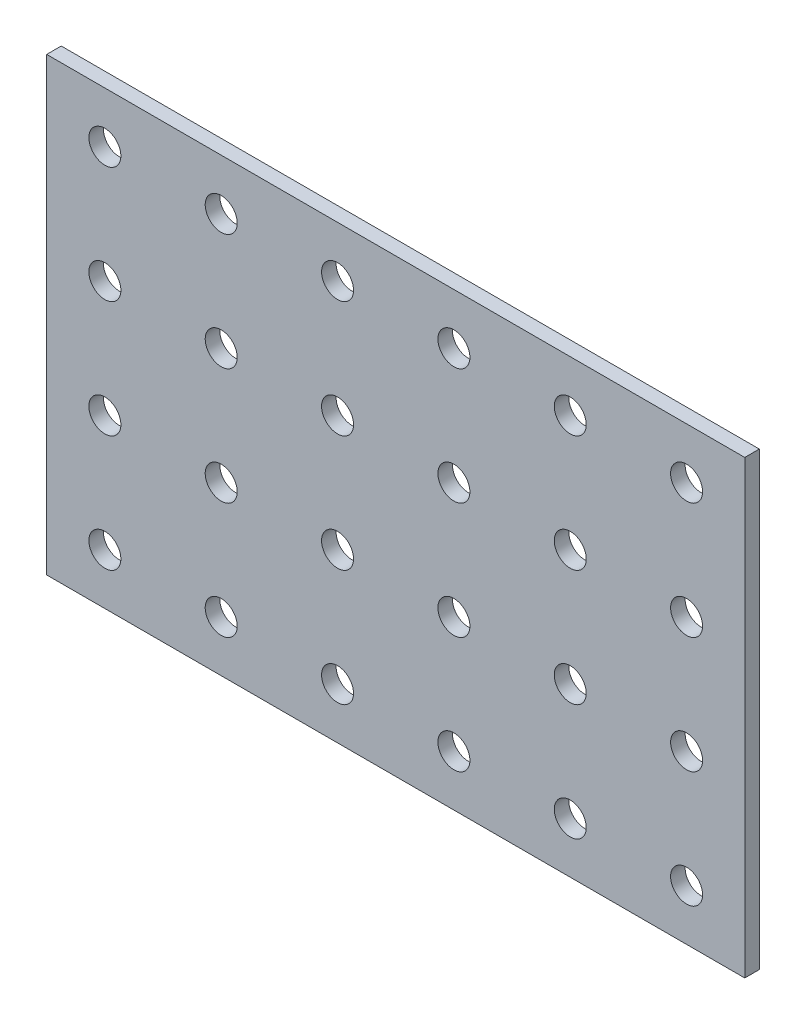
from build123d import *

# Parameters (mm, degrees)
SKETCH_1_W                  = 480
SKETCH_1_H                  = 310
EXTRUDE_1_DEPTH             = 10
SKETCH_2_R                  = 11
CUT_EXTRUDE_1_DEPTH         = 572.489282489
PATTERN_LINEAR_1_COUNT      = 6
PATTERN_LINEAR_1_PITCH      = 80
PATTERN_LINEAR_1_COUNT_DIR2 = 4
PATTERN_LINEAR_1_PITCH_DIR2 = 80


with BuildPart() as part:
    # 草图1 → 拉伸1 (new body)
    with BuildSketch(Plane.XY):
        with Locations((240, 155)):
            Rectangle(SKETCH_1_W, SKETCH_1_H)
    extrude(amount=EXTRUDE_1_DEPTH)

    # 草图2 → 切除-拉伸1 (cut, through all)
    with BuildSketch(Plane.XY.offset(10)):
        with Locations((40, 35)):
            Circle(SKETCH_2_R)
    cut_extrude_1 = extrude(amount=-CUT_EXTRUDE_1_DEPTH, mode=Mode.SUBTRACT)

    # 阵列(线性)1: Cut-Extrude 1 6 × 4
    with Locations(*[(i * PATTERN_LINEAR_1_PITCH, j * PATTERN_LINEAR_1_PITCH_DIR2, 0) for i in range(PATTERN_LINEAR_1_COUNT) for j in range(PATTERN_LINEAR_1_COUNT_DIR2) if (i, j) != (0, 0)]):
        add(cut_extrude_1, mode=Mode.SUBTRACT)


solid = part.part
